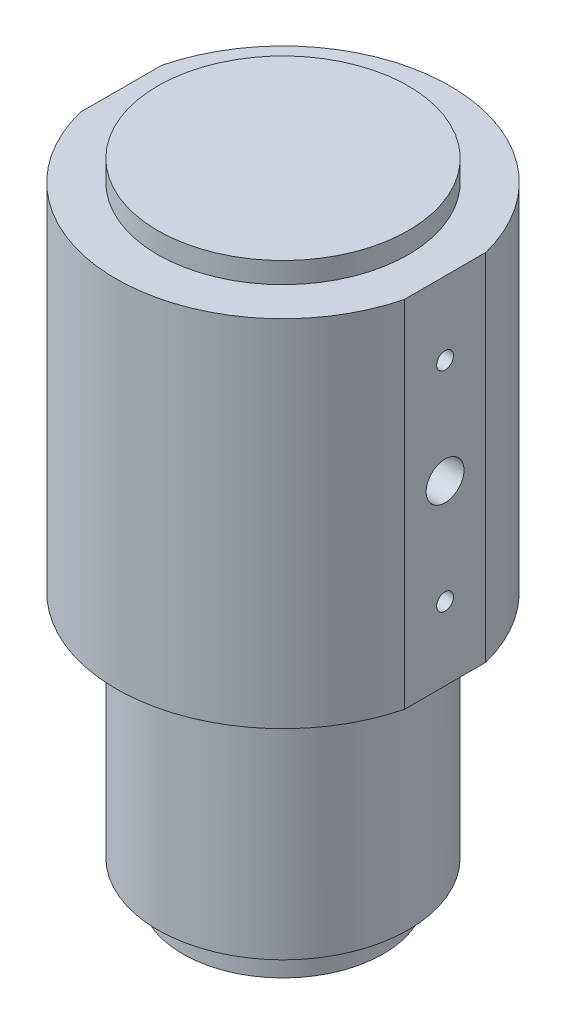
from build123d import *

# Parameters (mm, degrees)
SKETCH1_R               = 50.8
BOSS_EXTRUDE1_DEPTH     = 107.95
SKETCH2_R               = 38.1
BOSS_EXTRUDE2_DEPTH     = 6.35
BOSS_EXTRUDE3_START     = 69.85
SKETCH3_R               = 38.1
BOSS_EXTRUDE3_DEPTH     = 69.85
SKETCH4_R               = 30.48
BOSS_EXTRUDE4_DEPTH     = 10.16
SKETCH5_R               = 15.875
CUT_EXTRUDE1_DEPTH      = 82.55
SKETCH7_OUTSIDE_W       = 151.932
SKETCH7_OUTSIDE_H       = 151.932
SKETCH7_OUTSIDE_W_2     = 98.552
SKETCH7_OUTSIDE_H_2     = 127
CUT_EXTRUDE2_DEPTH      = 107.95
F_1_2_20_TAPPED_HOLE1_D = 11.50874
F_1_4_20_TAPPED_HOLE1_D = 5.1054


with BuildPart() as part:
    # Sketch1 → Boss-Extrude1 (new body)
    with BuildSketch(Plane(origin=(0, 0, 0), x_dir=(1, 0, 0), z_dir=(0, 1, 0))):
        with Locations(Location((0, 0, 0), (0, 0, 270))):
            Circle(SKETCH1_R)
    extrude(amount=BOSS_EXTRUDE1_DEPTH)

    # Sketch2 → Boss-Extrude2 (add)
    with BuildSketch(Plane(origin=(0, 107.95, 0), x_dir=(1, 0, 0), z_dir=(0, 1, 0))):
        with Locations(Location((0, 0, 0), (0, 0, 270))):
            Circle(SKETCH2_R)
    extrude(amount=BOSS_EXTRUDE2_DEPTH)

    # Sketch3 → Boss-Extrude3 (add)
    with BuildSketch(Plane.XZ.offset(BOSS_EXTRUDE3_START)):
        with Locations(Location((0, 0, 0), (0, 0, 90))):
            Circle(SKETCH3_R)
    extrude(amount=-BOSS_EXTRUDE3_DEPTH)

    # Sketch4 → Boss-Extrude4 (add)
    with BuildSketch(Plane.XZ.offset(69.85)):
        with Locations(Location((0, 0, 0), (0, 0, 270))):
            Circle(SKETCH4_R)
    extrude(amount=BOSS_EXTRUDE4_DEPTH)

    # Sketch5 → Cut-Extrude1 (cut)
    with BuildSketch(Plane.XZ.offset(80.01)):
        with Locations(Location((0, 0, 0), (0, 0, 270))):
            Circle(SKETCH5_R)
    extrude(amount=-CUT_EXTRUDE1_DEPTH, mode=Mode.SUBTRACT)

    # Sketch7 outside → Cut-Extrude2 (cut)
    with BuildSketch(Plane(origin=(0, 107.95, 0), x_dir=(1, 0, 0), z_dir=(0, 1, 0))):
        Rectangle(SKETCH7_OUTSIDE_W, SKETCH7_OUTSIDE_H)
        Rectangle(SKETCH7_OUTSIDE_W_2, SKETCH7_OUTSIDE_H_2, mode=Mode.SUBTRACT)
    extrude(amount=-CUT_EXTRUDE2_DEPTH, mode=Mode.SUBTRACT)

    # 1/2-20 Tapped Hole1 (through all)
    with Locations(Plane.ZY.offset(49.276)):
        with Locations((0, 53.975)):
            Hole(F_1_2_20_TAPPED_HOLE1_D / 2)

    # 1/4-20 Tapped Hole1 (through all)
    with Locations(Plane.ZY.offset(49.276)):
        with Locations((0, 85.725), (0, 22.225)):
            Hole(F_1_4_20_TAPPED_HOLE1_D / 2)


solid = part.part
